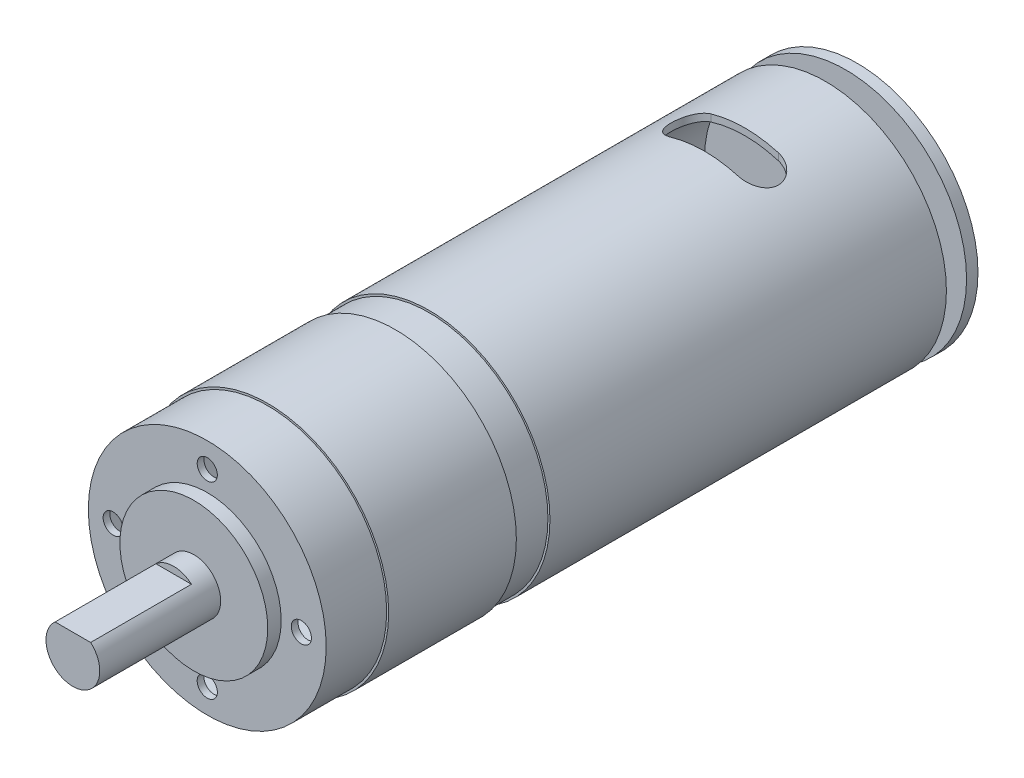
from build123d import *

# Parameters (mm, degrees)
SKETCH_1_R          = 18
EXTRUDE_1_DEPTH     = 92
CUT_EXTRUDE_2_DEPTH = 36
SHELL_8_T           = -1
SKETCH_2_R          = 11
EXTRUDE_2_DEPTH     = 2
SKETCH_3_R          = 4
EXTRUDE_3_DEPTH     = 18
CUT_EXTRUDE_START   = -15
CUT_EXTRUDE_1_DEPTH = 15
SKETCH_5_R          = 5
EXTRUDE_4_DEPTH     = 3
SKETCH_6_R          = 1.5
EXTRUDE_5_DEPTH     = 9
FILLET_1_R          = 1
SKETCH_8_R          = 1.5
CUT_EXTRUDE_3_DEPTH = 5
SKETCH_9_W          = 0.3
SKETCH_9_H          = 9
SKETCH_9_H_2        = 5
EXTRUDE_START       = 1.7
SKETCH_10_R         = 18
EXTRUDE_6_DEPTH     = 1.7
SKETCH_12_R         = 7.5
EXTRUDE_7_DEPTH     = 1.5


with BuildPart() as part:
    # 草图1 → 凸台-拉伸1 (new body)
    with BuildSketch(Plane.XY):
        Circle(SKETCH_1_R)
    extrude(amount=EXTRUDE_1_DEPTH)

    # 草图7 → 切除-拉伸2 (cut)
    with BuildSketch(Plane(origin=(0, 18, 0), x_dir=(1, 0, 0), z_dir=(0, 1, 0))):
        with BuildLine():
            Line((5, -18), (-5, -18))
            ThreePointArc((-5, -18), (-8, -15), (-5, -12))
            Line((-5, -12), (5, -12))
            ThreePointArc((5, -12), (8, -15), (5, -18))
        make_face()
    extrude(amount=-CUT_EXTRUDE_2_DEPTH, mode=Mode.SUBTRACT)

    # 抽壳8
    shell_8_openings = [part.faces().sort_by_distance(p)[0] for p in [
        (8, 0, 15),
        (0, 0, 18),
        (-8, 0, 15),
        (0, 0, 12),
    ]]
    offset(amount=SHELL_8_T, openings=shell_8_openings)

    # 草图2 → 凸台-拉伸2 (add)
    with BuildSketch(Plane.XY.offset(92)):
        Circle(SKETCH_2_R)
    extrude(amount=EXTRUDE_2_DEPTH)

    # 草图3 → 凸台-拉伸3 (add)
    with BuildSketch(Plane.XY.offset(94)):
        Circle(SKETCH_3_R)
    extrude(amount=EXTRUDE_3_DEPTH)

    # 草图4 → 切除-拉伸1 (cut)
    with BuildSketch(Plane.XY.offset(112).offset(CUT_EXTRUDE_START)):
        with BuildLine():
            ThreePointArc((2.645751311, 3), (1.414213562, 3.741657387), (0, 4))
            Line((0, 4), (0, 3))
            Line((0, 3), (2.645751311, 3))
        make_face()
        with BuildLine():
            Line((0, 3), (0, 4))
            ThreePointArc((0, 4), (-1.414213562, 3.741657387), (-2.645751311, 3))
            Line((-2.645751311, 3), (0, 3))
        make_face()
    extrude(amount=CUT_EXTRUDE_1_DEPTH, mode=Mode.SUBTRACT)

    # 草图5 → 凸台-拉伸4 (add)
    with BuildSketch(Plane(origin=(0, 0, 0), x_dir=(-1, 0, 0), z_dir=(0, 0, -1))):
        with Locations(Location((0, 0, 0), (0, 0, 180))):
            Circle(SKETCH_5_R)
    extrude(amount=EXTRUDE_4_DEPTH)

    # 草图6 → 凸台-拉伸5 (add)
    with BuildSketch(Plane(origin=(0, 0, -3), x_dir=(-1, 0, 0), z_dir=(0, 0, -1))):
        Circle(SKETCH_6_R)
    extrude(amount=EXTRUDE_5_DEPTH)

    # 圆角1
    fillet_1_edges = [part.edges().sort_by_distance(p)[0] for p in [
        (1.5, 0, -12),
    ]]
    fillet(fillet_1_edges, radius=FILLET_1_R)

    # 草图8 → 切除-拉伸3 (cut)
    with BuildSketch(Plane.XY.offset(92)):
        with Locations((14, 0)):
            Circle(SKETCH_8_R)
        with Locations((0, -14)):
            Circle(SKETCH_8_R)
        with Locations((-14, 0)):
            Circle(SKETCH_8_R)
        with Locations((0, 14)):
            Circle(SKETCH_8_R)
    extrude(amount=-CUT_EXTRUDE_3_DEPTH, mode=Mode.SUBTRACT)

    # 草图9 → 切除-旋转1 (revolve, cut)
    with BuildSketch(Plane(origin=(0, 0, 0), x_dir=(1, 0, 0), z_dir=(0, 1, 0)), mode=Mode.PRIVATE) as cut_revolve_1_sk:
        with Locations((17.85, -87.5)):
            Rectangle(SKETCH_9_W, SKETCH_9_H)
        with Locations((17.85, -61.5)):
            Rectangle(SKETCH_9_W, SKETCH_9_H_2)
    revolve(cut_revolve_1_sk.sketch.rotate(Axis((0, 0, 0), (0, 0, 1)), 180), axis=Axis((0, 0, 0), (0, 0, 1)), mode=Mode.SUBTRACT)

    # 草图10 → 凸台-拉伸6 (add)
    with BuildSketch(Plane(origin=(0, 0, -3), x_dir=(-1, 0, 0), z_dir=(0, 0, -1)).offset(EXTRUDE_START)):
        Circle(SKETCH_10_R)
    extrude(amount=-EXTRUDE_6_DEPTH)

    # 草图12 → 凸台-拉伸7 (add, symmetric)
    with BuildSketch(Plane(origin=(0, 0, -8.3), x_dir=(-1, 0, 0), z_dir=(0, 0, -1))):
        Circle(SKETCH_12_R)
    extrude(amount=EXTRUDE_7_DEPTH, both=True)


solid = part.part
